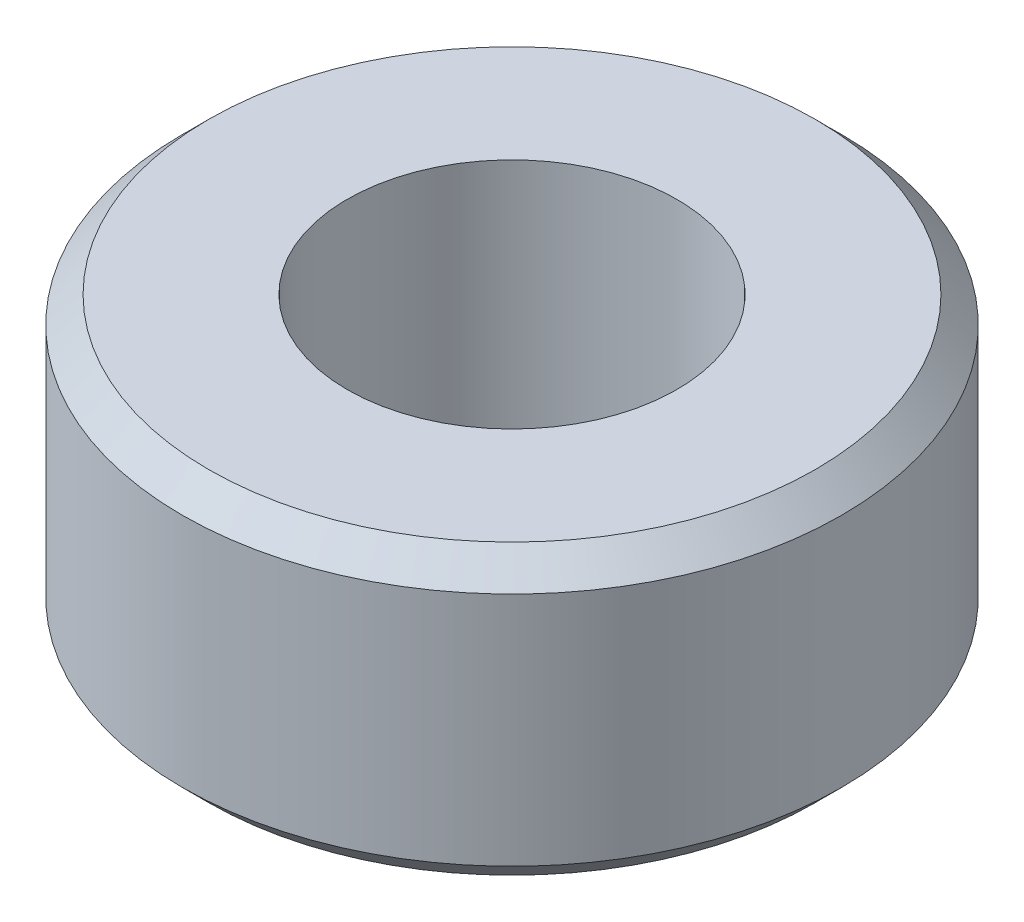
from build123d import *

# Parameters (mm, degrees)
SKETCH1_R           = 3.175
SKETCH1_R_2         = 1.5875
BOSS_EXTRUDE1_DEPTH = 2.778125
CHAMFER1_SIZE       = 0.254


with BuildPart() as part:
    # Sketch1 → Boss-Extrude1 (new body)
    with BuildSketch(Plane(origin=(0, 0, 0), x_dir=(1, 0, 0), z_dir=(0, 1, 0))):
        with Locations(Location((0, 0, 0), (0, 0, 270))):
            Circle(SKETCH1_R)
        with Locations(Location((0, 0, 0), (0, 0, 270))):
            Circle(SKETCH1_R_2, mode=Mode.SUBTRACT)
    extrude(amount=BOSS_EXTRUDE1_DEPTH)

    # Chamfer1
    chamfer1_edges = [part.edges().sort_by_distance(p)[0] for p in [
        (0, 0, -3.175),
        (0, 2.778125, -3.175),
    ]]
    chamfer(chamfer1_edges, length=CHAMFER1_SIZE)


solid = part.part
